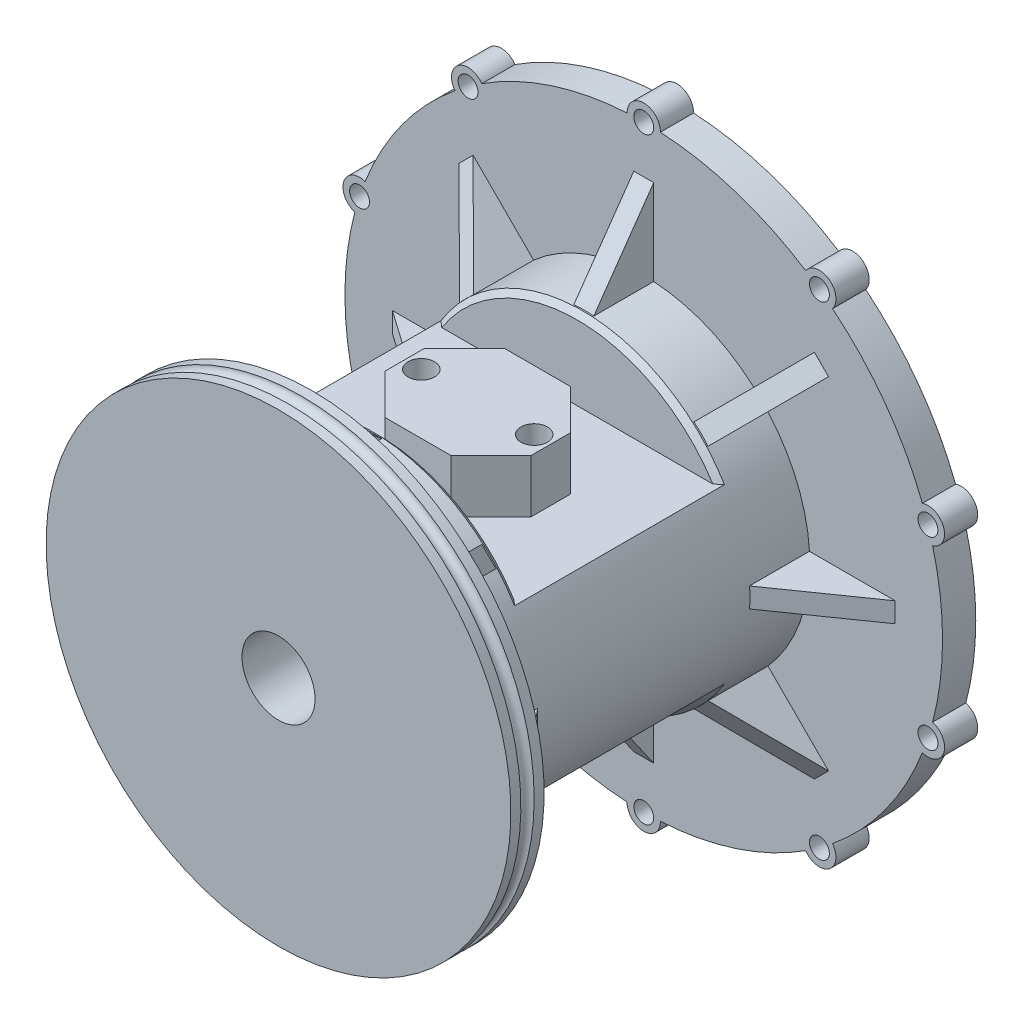
from build123d import *

# Parameters (mm, degrees)
SKETCH1_R           = 45
BOSS_EXTRUDE1_DEPTH = 60
RIB8_REACH          = 89.464
SKETCH4_WALL_W      = 192.619578006
SKETCH4_WALL_H      = 3
RIB9_REACH          = 89.464
SKETCH5_WALL_W      = 188.67722245
SKETCH5_WALL_H      = 3
CIRPATTERN1_COUNT   = 8
SKETCH6_W           = 6
SKETCH6_H           = 12
CUT_EXTRUDE1_DEPTH  = 30
CUT_EXTRUDE2_DEPTH  = 18
CHAMFER1_SIZE       = 0.8
CHAMFER2_SIZE       = 6
SKETCH10_R          = 2
CUT_EXTRUDE3_DEPTH  = 100.904954832
SKETCH11_R          = 2.5
BOSS_EXTRUDE2_DEPTH = 5
SKETCH12_R          = 1.5
CUT_EXTRUDE4_DEPTH  = 5
SKETCH13_R          = 1


with BuildPart() as part:
    # Sketch1 → Boss-Extrude1 (new body)
    with BuildSketch(Plane.XY):
        Circle(SKETCH1_R)
    extrude(amount=BOSS_EXTRUDE1_DEPTH)

    # Sketch3 → Cut-Revolve1 (revolve, cut)
    with BuildSketch(Plane(origin=(0, 0, 0), x_dir=(0, 0, -1), z_dir=(1, 0, 0))):
        Polygon((0, 27.5), (0, 0), (-60, 0), (-60, 5.5), (-2, 5.5), (-2, 27.5), align=None)
        Polygon((-5, 45), (-5, 25), (-55, 25), (-55, 35), (-60, 35), (-60, 45), align=None)
    revolve(axis=Axis((0, 0, 0), (0, 0, 1)), mode=Mode.SUBTRACT)

    # Sketch4 wall → Rib8 (add, up to next)
    with BuildSketch(Plane(origin=(0, 31.426666031, 9.5), x_dir=(0, -0.819152044296, 0.573576436341), z_dir=(0, -0.573576436341, -0.819152044296)), mode=Mode.PRIVATE) as rib8_sk1:
        Rectangle(SKETCH4_WALL_W, SKETCH4_WALL_H)
    rib8_tool1 = extrude(rib8_sk1.sketch, amount=RIB8_REACH, mode=Mode.PRIVATE) - part.part
    rib8 = rib8_tool1.solids().sort_by_distance((0, 31.426666031, 9.5))[0]
    add(rib8)

    # Sketch5 wall → Rib9 (add, up to next)
    with BuildSketch(Plane(origin=(0, 28.775948341, 50.5), x_dir=(0, -0.642787609707, -0.766044443102), z_dir=(0, 0.766044443102, -0.642787609707)), mode=Mode.PRIVATE) as rib9_sk1:
        Rectangle(SKETCH5_WALL_W, SKETCH5_WALL_H)
    rib9_tool1 = extrude(rib9_sk1.sketch, amount=-RIB9_REACH, mode=Mode.PRIVATE) - part.part
    rib9 = rib9_tool1.solids().sort_by_distance((0, 28.775948341, 50.5))[0]
    add(rib9)

    # CirPattern1: Rib8, Rib9 ×8 about axis
    cirpattern1_axis = Axis((0, 0, 0), (0, 0, 1))
    add([rib8.rotate(cirpattern1_axis, i * 360 / CIRPATTERN1_COUNT) for i in range(1, CIRPATTERN1_COUNT)])
    add([rib9.rotate(cirpattern1_axis, i * 360 / CIRPATTERN1_COUNT) for i in range(1, CIRPATTERN1_COUNT)])

    # Sketch6 → Cut-Extrude1 (cut, symmetric)
    with BuildSketch(Plane(origin=(0, 0, 0), x_dir=(0, 0, -1), z_dir=(1, 0, 0))):
        with Locations((-18, 19)):
            Rectangle(SKETCH6_W, SKETCH6_H)
        with Locations((-42, 19)):
            Rectangle(SKETCH6_W, SKETCH6_H)
        with Locations((-42, -19)):
            Rectangle(SKETCH6_W, SKETCH6_H)
        with Locations((-18, -19)):
            Rectangle(SKETCH6_W, SKETCH6_H)
    extrude(amount=CUT_EXTRUDE1_DEPTH, both=True, mode=Mode.SUBTRACT)

    # Sketch8 → Cut-Extrude2 (cut)
    with BuildSketch(Plane(origin=(0, 0, 21), x_dir=(-1, 0, 0), z_dir=(0, 0, -1))):
        Polygon((-11, 13), (-11, 21), (11, 21), (11, 13), (26.229477205, 13), (26.229477205, 31.577824801), (-25.591324377, 31.577824801), (-25.591324377, 13), align=None)
        Polygon((-25.591324377, -13), (-11, -13), (-11, -21), (11, -21), (11, -13), (26.229477205, -13), (26.229477205, -31.577824801), (-25.591324377, -31.577824801), align=None)
    extrude(amount=-CUT_EXTRUDE2_DEPTH, mode=Mode.SUBTRACT)

    # Chamfer1
    chamfer1_edges = [part.edges().sort_by_distance(p)[0] for p in [
        (-12.247448714, 21.794494718, 15),
        (12.247448714, 21.794494718, 45),
        (0, -25, 45),
        (0, -25, 15),
    ]]
    chamfer(chamfer1_edges, length=CHAMFER1_SIZE)

    # Chamfer2
    chamfer2_edges = [part.edges().sort_by_distance(p)[0] for p in [
        (11, 17, 21),
        (-11, 17, 21),
        (-11, 17, 39),
        (11, 17, 39),
        (11, -17, 39),
        (-11, -17, 39),
        (-11, -17, 21),
        (11, -17, 21),
    ]]
    chamfer(chamfer2_edges, length=CHAMFER2_SIZE)

    # Sketch10 → Cut-Extrude3 (cut, through all)
    with BuildSketch(Plane.XZ.offset(21)):
        with Locations(Location((-8.5, 30, 0), (0, 0, 270))):
            Circle(SKETCH10_R)
        with Locations(Location((8.5, 30, 0), (0, 0, 270))):
            Circle(SKETCH10_R)
    extrude(amount=-CUT_EXTRUDE3_DEPTH, mode=Mode.SUBTRACT)

    # Sketch11 → Boss-Extrude2 (add)
    with BuildSketch(Plane(origin=(0, 0, 0), x_dir=(-1, 0, 0), z_dir=(0, 0, -1))):
        with Locations((0, 45)):
            Circle(SKETCH11_R)
        with Locations((26.450336353, 36.405764747)):
            Circle(SKETCH11_R)
        with Locations((42.797543233, 13.905764747)):
            Circle(SKETCH11_R)
        with Locations((42.797543233, -13.905764747)):
            Circle(SKETCH11_R)
        with Locations((26.450336353, -36.405764747)):
            Circle(SKETCH11_R)
        with Locations((0, -45)):
            Circle(SKETCH11_R)
        with Locations((-26.450336353, -36.405764747)):
            Circle(SKETCH11_R)
        with Locations((-42.797543233, -13.905764747)):
            Circle(SKETCH11_R)
        with Locations((-42.797543233, 13.905764747)):
            Circle(SKETCH11_R)
        with Locations((-26.450336353, 36.405764747)):
            Circle(SKETCH11_R)
    extrude(amount=-BOSS_EXTRUDE2_DEPTH)

    # Sketch12 → Cut-Extrude4 (cut)
    with BuildSketch(Plane(origin=(0, 0, 0), x_dir=(-1, 0, 0), z_dir=(0, 0, -1))):
        with Locations((0, 45)):
            Circle(SKETCH12_R)
        with Locations((26.450336353, 36.405764747)):
            Circle(SKETCH12_R)
        with Locations((42.797543233, 13.905764747)):
            Circle(SKETCH12_R)
        with Locations((42.797543233, -13.905764747)):
            Circle(SKETCH12_R)
        with Locations((26.450336353, -36.405764747)):
            Circle(SKETCH12_R)
        with Locations((0, -45)):
            Circle(SKETCH12_R)
        with Locations((-26.450336353, -36.405764747)):
            Circle(SKETCH12_R)
        with Locations((-42.797543233, -13.905764747)):
            Circle(SKETCH12_R)
        with Locations((-42.797543233, 13.905764747)):
            Circle(SKETCH12_R)
        with Locations((-26.450336353, 36.405764747)):
            Circle(SKETCH12_R)
    extrude(amount=-CUT_EXTRUDE4_DEPTH, mode=Mode.SUBTRACT)

    # Sketch13 → Cut-Revolve2 (revolve, cut)
    with BuildSketch(Plane(origin=(0, 0, 0), x_dir=(1, 0, 0), z_dir=(0, 1, 0)), mode=Mode.PRIVATE) as cut_revolve2_sk:
        with Locations((35, -57.5)):
            Circle(SKETCH13_R)
    revolve(cut_revolve2_sk.sketch.rotate(Axis((0, 0, 0), (0, 0, 1)), 90), axis=Axis((0, 0, 0), (0, 0, 1)), mode=Mode.SUBTRACT)


solid = part.part
